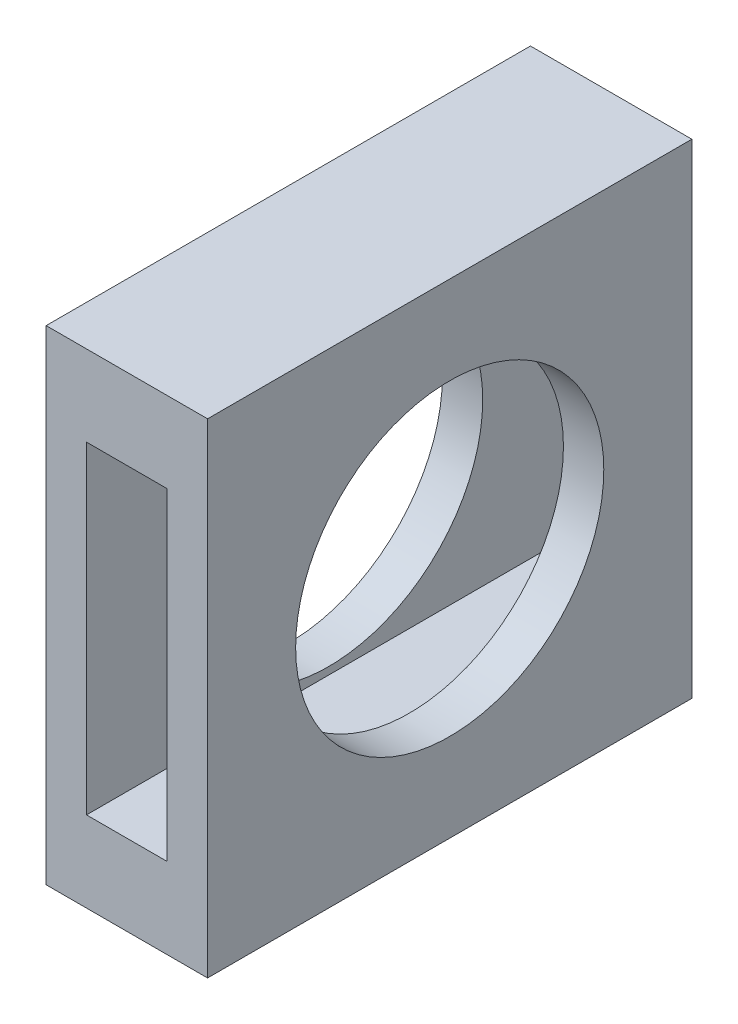
from build123d import *

# Parameters (mm, degrees)
SKETCH_1_W          = 10
SKETCH_1_H          = 30
SKETCH_1_W_2        = 5
SKETCH_1_H_2        = 20
EXTRUDE_1_DEPTH     = 15
SKETCH_2_R          = 9.544400842
CUT_EXTRUDE_1_DEPTH = 30


with BuildPart() as part:
    # 草图1 → 凸台-拉伸1 (new, symmetric)
    with BuildSketch(Plane.XY):
        Rectangle(SKETCH_1_W, SKETCH_1_H)
        Rectangle(SKETCH_1_W_2, SKETCH_1_H_2, mode=Mode.SUBTRACT)
    extrude(amount=EXTRUDE_1_DEPTH, both=True)

    # 草图2 → 切除-拉伸1 (cut)
    with BuildSketch(Plane(origin=(5, 0, 0), x_dir=(0, 0, -1), z_dir=(1, 0, 0))):
        Circle(SKETCH_2_R)
    extrude(amount=-CUT_EXTRUDE_1_DEPTH, mode=Mode.SUBTRACT)


solid = part.part
